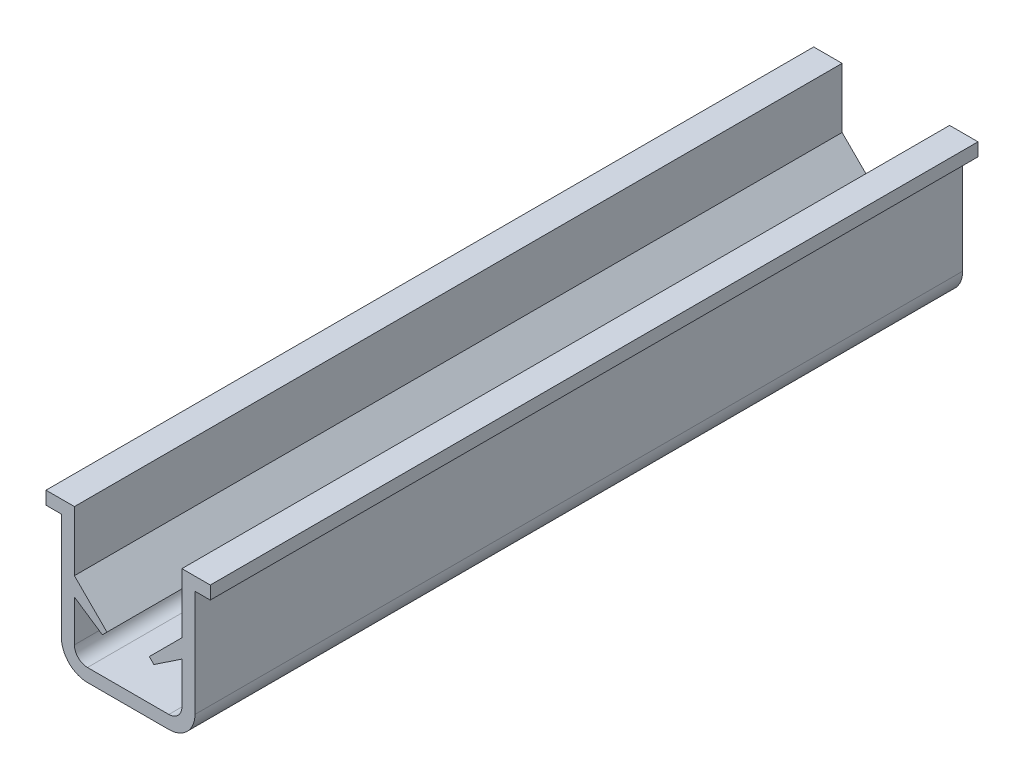
from build123d import *

# Parameters (mm, degrees)
EXTRUDE_1_DEPTH = 50


with BuildPart() as part:
    # 草图1 → 凸台-拉伸1 (new body)
    with BuildSketch(Plane.XY):
        with BuildLine():
            Line((-3.068719851, 0.075307347), (-3.068719851, 3.975307347))
            Line((-3.068719851, 3.975307347), (-4.918719851, 3.975307347))
            Line((-4.918719851, 3.975307347), (-4.918719851, 3.125307347))
            Line((-4.918719851, 3.125307347), (-3.918719851, 3.125307347))
            Line((-3.918719851, 3.125307347), (-3.918719851, -3.824692653))
            ThreePointArc((-3.918719851, -3.824692653), (-3.420801379, -5.026774181), (-2.218719851, -5.524692653))
            Line((-2.218719851, -5.524692653), (3.081280149, -5.524692653))
            ThreePointArc((3.081280149, -5.524692653), (4.283361677, -5.026774181), (4.781280149, -3.824692653))
            Line((4.781280149, -3.824692653), (4.781280149, 3.125307347))
            Line((4.781280149, 3.125307347), (5.781280149, 3.125307347))
            Line((5.781280149, 3.125307347), (5.781280149, 3.975307347))
            Line((5.781280149, 3.975307347), (3.931280149, 3.975307347))
            Line((3.931280149, 3.975307347), (3.931280149, 0.075307347))
            Line((3.931280149, 0.075307347), (1.809959806, -2.046012996))
            Line((1.809959806, -2.046012996), (2.110480188, -2.346533378))
            Line((2.110480188, -2.346533378), (3.931280149, -1.126774181))
            Line((3.931280149, -1.126774181), (3.931280149, -3.824692653))
            ThreePointArc((3.931280149, -3.824692653), (3.682320913, -4.425733417), (3.081280149, -4.674692653))
            Line((3.081280149, -4.674692653), (-2.218719851, -4.674692653))
            ThreePointArc((-2.218719851, -4.674692653), (-2.819760615, -4.425733417), (-3.068719851, -3.824692653))
            Line((-3.068719851, -3.824692653), (-3.068719851, -1.126774181))
            Line((-3.068719851, -1.126774181), (-1.247919889, -2.346533378))
            Line((-1.247919889, -2.346533378), (-0.947399507, -2.046012996))
            Line((-0.947399507, -2.046012996), (-3.068719851, 0.075307347))
        make_face()
    extrude(amount=EXTRUDE_1_DEPTH)


solid = part.part
